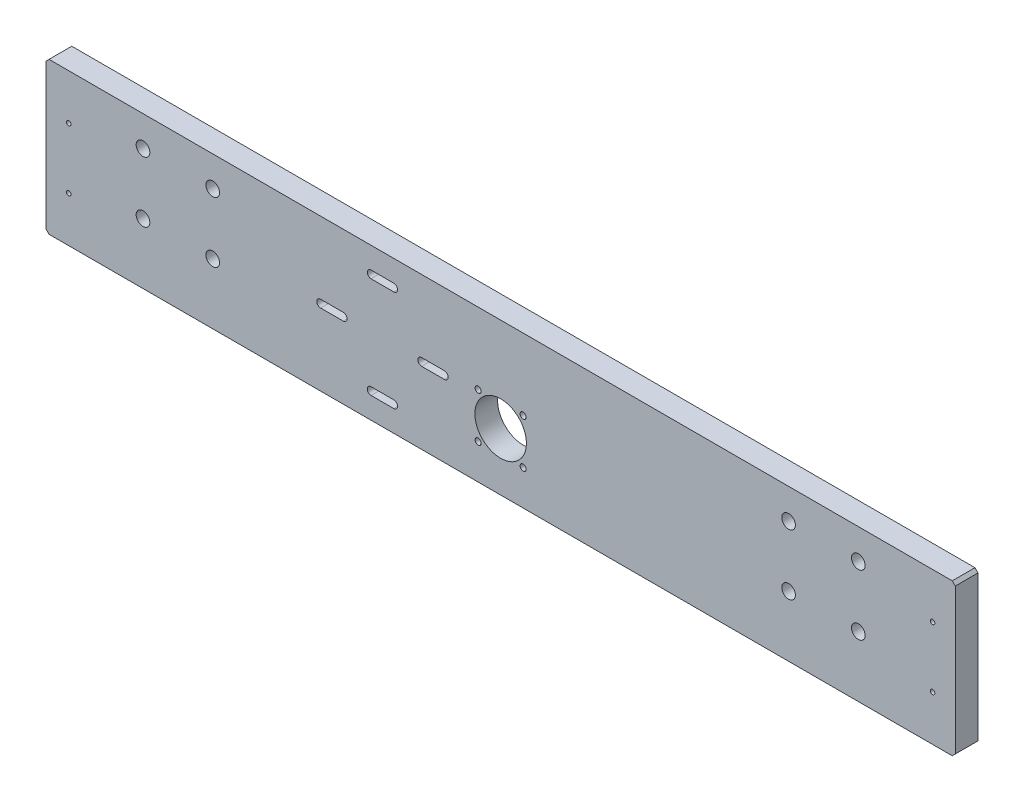
from build123d import *

# Parameters (mm, degrees)
SCHIZZO1_R            = 17
SCHIZZO1_R_2          = 2
SCHIZZO1_R_3          = 4.5
SCHIZZO1_R_4          = 1.5
BOSS_EXTRUDE1_DEPTH   = 15
M8_TAPPED_HOLE1_D     = 6.8
M8_TAPPED_HOLE1_DEPTH = 23.75
M8_TAPPED_HOLE1_TIP   = 2.042926105
CUT_EXTRUDE1_DEPTH    = 609.461173782


with BuildPart() as part:
    # Schizzo1 → Boss-Extrude1 (new body)
    with BuildSketch(Plane.XY):
        Polygon((2, 0), (598, 0), (600, 2), (600, 98), (598, 100), (2, 100), (0, 98), (0, 2), align=None)
        with Locations((300, 38)):
            Circle(SCHIZZO1_R, mode=Mode.SUBTRACT)
        with Locations(Location((314.849242405, 52.849242405, 0), (0, 0, 180))):
            Circle(SCHIZZO1_R_2, mode=Mode.SUBTRACT)
        with Locations((314.849242405, 23.150757595)):
            Circle(SCHIZZO1_R_2, mode=Mode.SUBTRACT)
        with Locations(Location((285.150757595, 23.150757595, 0), (0, 0, 180))):
            Circle(SCHIZZO1_R_2, mode=Mode.SUBTRACT)
        with Locations(Location((536, 40, 0), (0, 0, 180))):
            Circle(SCHIZZO1_R_3, mode=Mode.SUBTRACT)
        with Locations(Location((536, 80, 0), (0, 0, 180))):
            Circle(SCHIZZO1_R_3, mode=Mode.SUBTRACT)
        with Locations((490, 40)):
            Circle(SCHIZZO1_R_3, mode=Mode.SUBTRACT)
        with Locations((490, 80)):
            Circle(SCHIZZO1_R_3, mode=Mode.SUBTRACT)
        with Locations((585, 70)):
            Circle(SCHIZZO1_R_4, mode=Mode.SUBTRACT)
        with Locations(Location((585, 30, 0), (0, 0, 180))):
            Circle(SCHIZZO1_R_4, mode=Mode.SUBTRACT)
        with Locations((15, 30)):
            Circle(SCHIZZO1_R_4, mode=Mode.SUBTRACT)
        with Locations((285.150757595, 52.849242405)):
            Circle(SCHIZZO1_R_2, mode=Mode.SUBTRACT)
        with Locations(Location((15, 70, 0), (0, 0, 180))):
            Circle(SCHIZZO1_R_4, mode=Mode.SUBTRACT)
        with Locations(Location((110, 80, 0), (0, 0, 180))):
            Circle(SCHIZZO1_R_3, mode=Mode.SUBTRACT)
        with Locations(Location((110, 40, 0), (0, 0, 180))):
            Circle(SCHIZZO1_R_3, mode=Mode.SUBTRACT)
        with Locations((64, 80)):
            Circle(SCHIZZO1_R_3, mode=Mode.SUBTRACT)
        with Locations((64, 40)):
            Circle(SCHIZZO1_R_3, mode=Mode.SUBTRACT)
    extrude(amount=-BOSS_EXTRUDE1_DEPTH)

    # M8 Tapped Hole1
    with Locations(Plane(origin=(30, 0, -7.5), x_dir=(0, 0, -1), z_dir=(0, -1, 0))):
        with Locations((0, 0), (0, 540)):
            Hole(M8_TAPPED_HOLE1_D / 2, depth=M8_TAPPED_HOLE1_DEPTH)
            with Locations((0, 0, -(M8_TAPPED_HOLE1_DEPTH + M8_TAPPED_HOLE1_TIP / 2))):  # 118° drill point
                Cone(0, M8_TAPPED_HOLE1_D / 2, M8_TAPPED_HOLE1_TIP, mode=Mode.SUBTRACT)

    # Sketch7 → Cut-Extrude1 (cut, through all)
    with BuildSketch(Plane(origin=(0, 0, -15), x_dir=(-1, 0, 0), z_dir=(0, 0, -1))):
        with BuildLine():
            Line((-214.5, 80.833013665), (-229.5, 80.833013665))
            ThreePointArc((-229.5, 80.833013665), (-232, 83.333013665), (-229.5, 85.833013665))
            Line((-229.5, 85.833013665), (-214.5, 85.833013665))
            ThreePointArc((-214.5, 85.833013665), (-212, 83.333013665), (-214.5, 80.833013665))
        make_face()
        with BuildLine():
            Line((-247.833013665, 47.5), (-262.833013665, 47.5))
            ThreePointArc((-262.833013665, 47.5), (-265.333013665, 50), (-262.833013665, 52.5))
            Line((-262.833013665, 52.5), (-247.833013665, 52.5))
            ThreePointArc((-247.833013665, 52.5), (-245.333013665, 50), (-247.833013665, 47.5))
        make_face()
        with BuildLine():
            Line((-181.173013665, 47.5), (-196.173013665, 47.5))
            ThreePointArc((-196.173013665, 47.5), (-198.673013665, 50), (-196.173013665, 52.5))
            Line((-196.173013665, 52.5), (-181.173013665, 52.5))
            ThreePointArc((-181.173013665, 52.5), (-178.673013665, 50), (-181.173013665, 47.5))
        make_face()
        with BuildLine():
            Line((-214.5, 14.173013665), (-229.5, 14.173013665))
            ThreePointArc((-229.5, 14.173013665), (-232, 16.673013665), (-229.5, 19.173013665))
            Line((-229.5, 19.173013665), (-214.5, 19.173013665))
            ThreePointArc((-214.5, 19.173013665), (-212, 16.673013665), (-214.5, 14.173013665))
        make_face()
    extrude(amount=-CUT_EXTRUDE1_DEPTH, mode=Mode.SUBTRACT)


solid = part.part
